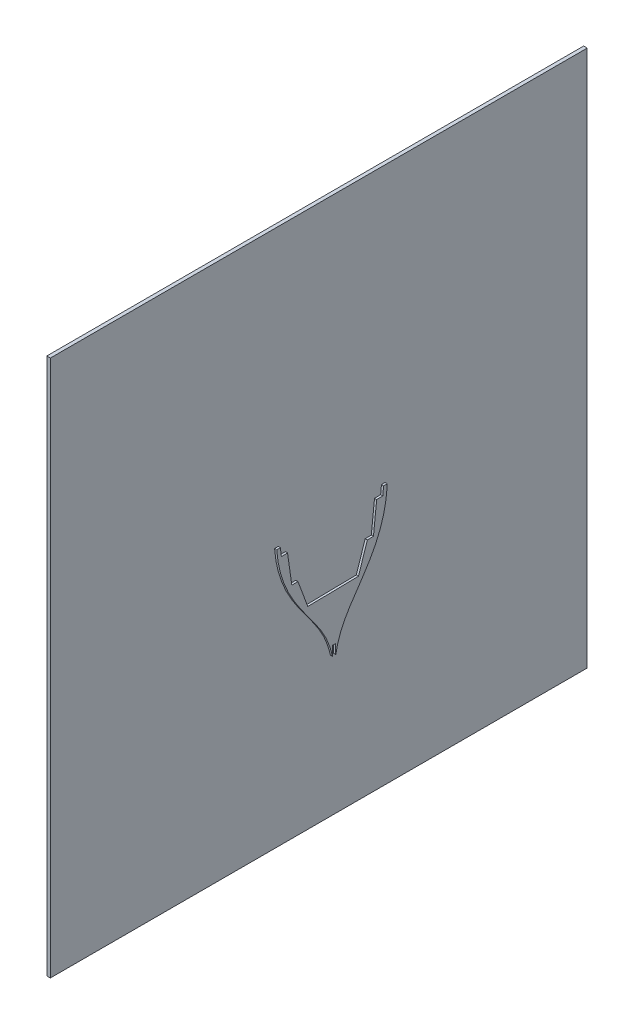
from build123d import *

# Parameters (mm, degrees)
BOSS_EXTRU_2_DEPTH      = 10
BOSS_EXTRU_3_DEPTH      = 6
ENL_V_MAT_EXTRU_1_DEPTH = 6


with BuildPart() as part:
    # Esquisse3D1 → Boss.-Extru.2 (new body)
    with BuildSketch(Plane(origin=(-20, 1121.289346724, 777.274991403), x_dir=(0, -0.7071067811865476, -0.7071067811865476), z_dir=(1, 0, 0))):
        Polygon((0, 0), (1060.66017178, 1060.66017178), (2121.32034356, 0), (1060.66017178, -1060.66017178), align=None)
    extrude(amount=BOSS_EXTRU_2_DEPTH)


with BuildPart() as body_2:
    # Esquisse5 → Boss.-Extru.3 (new body)
    with BuildSketch(Plane(origin=(0, 0, 0), x_dir=(0, 0, -1), z_dir=(1, 0, 0))):
        with BuildLine():
            Line((147.698680125, 362.671205325), (137.698680125, 362.490051553))
            Line((137.698680125, 362.490051553), (135.521913269, 339.299509241))
            Line((135.521913269, 339.299509241), (118.411279765, 338.98954366))
            Line((118.411279765, 338.98954366), (109.445247044, 254.603893018))
            Line((109.445247044, 254.603893018), (92.373957202, 254.294640162))
            Line((92.373957202, 254.294640162), (67.56268558, 179.082154003))
            Line((67.56268558, 179.082154003), (-74.004509473, 176.517610858))
            Line((-74.004509473, 176.517610858), (-101.52361312, 250.782112527))
            Line((-101.52361312, 250.782112527), (-118.594902962, 250.472859671))
            Line((-118.594902962, 250.472859671), (-130.611405702, 334.478403767))
            Line((-130.611405702, 334.478403767), (-147.722039206, 334.168438186))
            Line((-147.722039206, 334.168438186), (-150.737313052, 357.264924722))
            Line((-150.737313052, 357.264924722), (-160.737313052, 357.083770949))
            add(Edge.make_bspline(
                [(0, 0), (-14.586676597, 60.362422447), (-19.632652429, 131.135423655), (-147.791780291, 176.989338925), (-160.737313052, 357.083770949)],
                knots=[0, 0, 0, 0, 0, 1, 1, 1, 1, 1], degree=4))
            add(Edge.make_bspline(
                [(0, 0), (12.390847358, 60.851130471), (14.870194395, 131.760455742), (141.284457751, 182.226064033), (147.698680125, 362.671205325)],
                knots=[0, 0, 0, 0, 0, 1, 1, 1, 1, 1], degree=4))
        make_face()
    extrude(amount=BOSS_EXTRU_3_DEPTH)

    # Esquisse6 → Enlèv. mat.-Extru.1 (cut)
    with BuildSketch(Plane(origin=(6, 0, 0), x_dir=(0, 0, -1), z_dir=(1, 0, 0))):
        Polygon((-4.882335547, 21.024060985), (-5.371450733, 48.024060985), (3.628549267, 48.18709938), (4.117664453, 21.18709938), (117.063261114, -47.52702125), (-85.227699586, -65.220017949), align=None)
    extrude(amount=-ENL_V_MAT_EXTRU_1_DEPTH, mode=Mode.SUBTRACT)


solid = Compound([part.part, body_2.part])
